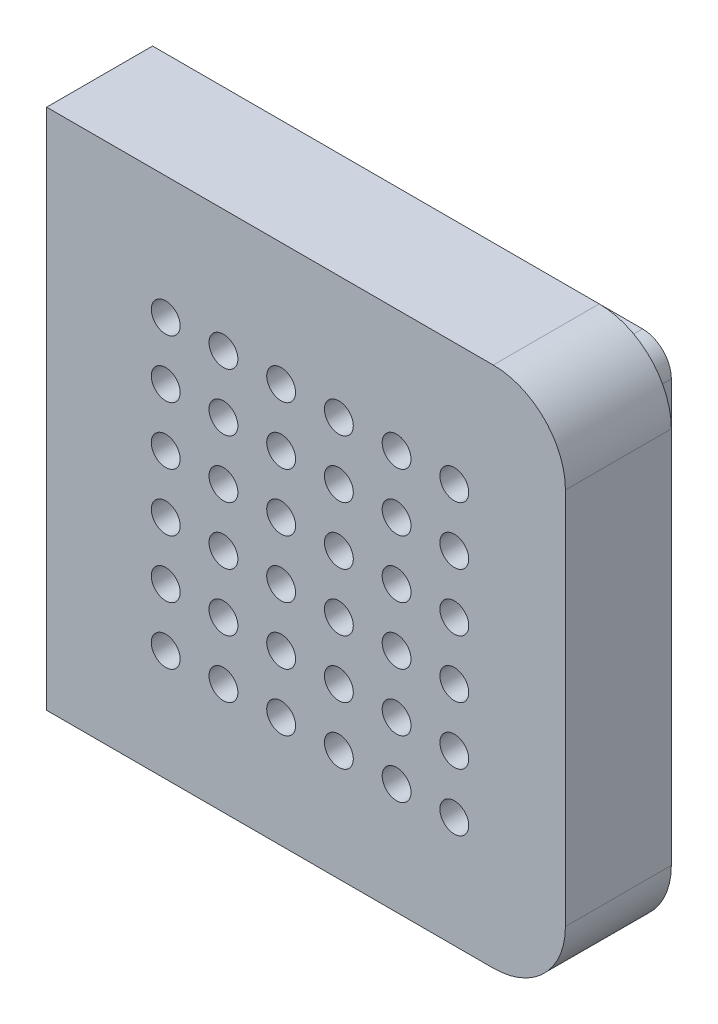
from build123d import *

# Parameters (mm, degrees)
BOSS_EXTRUDE1_DEPTH = 3.67
SKETCH6_R           = 0.5
CUT_EXTRUDE1_DEPTH  = 3.67
SKETCH20_W          = 12.1
SKETCH20_H          = 12.1
BOSS_EXTRUDE4_DEPTH = 1.5
SKETCH13_W          = 1
SKETCH13_H          = 0.5
CUT_EXTRUDE7_DEPTH  = 0.5
SKETCH14_R          = 0.125
CUT_EXTRUDE8_DEPTH  = 0.25
CUT_EXTRUDE9_START  = -0.25
SKETCH15_R          = 0.125
CUT_EXTRUDE9_DEPTH  = 0.25
CUT_EXTRUDE10_START = -0.25
SKETCH16_R          = 0.125
CUT_EXTRUDE10_DEPTH = 0.25
SKETCH17_R          = 0.125
CUT_EXTRUDE11_DEPTH = 0.25
SKETCH19_W          = 3.67
SKETCH19_H          = 18.1
CUT_EXTRUDE13_DEPTH = 0.125
CUT_EXTRUDE14_REACH = 22.457


with BuildPart() as part:
    # Sketch1 → Boss-Extrude1 (new body)
    with BuildSketch(Plane.XY):
        with BuildLine():
            Line((-7.8, 9.05), (7.8, 9.05))
            ThreePointArc((7.8, 9.05), (9.567766953, 8.317766953), (10.3, 6.55))
            Line((10.3, 6.55), (10.3, -6.55))
            ThreePointArc((10.3, -6.55), (9.567766953, -8.317766953), (7.8, -9.05))
            Line((7.8, -9.05), (-7.8, -9.05))
            Line((-7.8, -9.05), (-7.8, 9.05))
        make_face()
    extrude(amount=BOSS_EXTRUDE1_DEPTH)

    # Sketch6 → Cut-Extrude1 (cut)
    with BuildSketch(Plane.XY.offset(3.67)):
        with Locations((-3.55, 4.8)):
            Circle(SKETCH6_R)
        with Locations((-1.55, 4.8)):
            Circle(SKETCH6_R)
        with Locations((0.45, 4.8)):
            Circle(SKETCH6_R)
        with Locations((2.45, 4.8)):
            Circle(SKETCH6_R)
        with Locations((4.45, 4.8)):
            Circle(SKETCH6_R)
        with Locations((6.45, 4.8)):
            Circle(SKETCH6_R)
        with Locations((-1.55, 2.8)):
            Circle(SKETCH6_R)
        with Locations((0.45, 2.8)):
            Circle(SKETCH6_R)
        with Locations((2.45, 2.8)):
            Circle(SKETCH6_R)
        with Locations((4.45, 2.8)):
            Circle(SKETCH6_R)
        with Locations((6.45, 2.8)):
            Circle(SKETCH6_R)
        with Locations((-1.55, 0.8)):
            Circle(SKETCH6_R)
        with Locations((0.45, 0.8)):
            Circle(SKETCH6_R)
        with Locations((2.45, 0.8)):
            Circle(SKETCH6_R)
        with Locations((4.45, 0.8)):
            Circle(SKETCH6_R)
        with Locations((6.45, 0.8)):
            Circle(SKETCH6_R)
        with Locations((-1.55, -1.2)):
            Circle(SKETCH6_R)
        with Locations((0.45, -1.2)):
            Circle(SKETCH6_R)
        with Locations((2.45, -1.2)):
            Circle(SKETCH6_R)
        with Locations((4.45, -1.2)):
            Circle(SKETCH6_R)
        with Locations((6.45, -1.2)):
            Circle(SKETCH6_R)
        with Locations((-1.55, -3.2)):
            Circle(SKETCH6_R)
        with Locations((0.45, -3.2)):
            Circle(SKETCH6_R)
        with Locations((2.45, -3.2)):
            Circle(SKETCH6_R)
        with Locations((4.45, -3.2)):
            Circle(SKETCH6_R)
        with Locations((6.45, -3.2)):
            Circle(SKETCH6_R)
        with Locations((-1.55, -5.2)):
            Circle(SKETCH6_R)
        with Locations((0.45, -5.2)):
            Circle(SKETCH6_R)
        with Locations((2.45, -5.2)):
            Circle(SKETCH6_R)
        with Locations((4.45, -5.2)):
            Circle(SKETCH6_R)
        with Locations((6.45, -5.2)):
            Circle(SKETCH6_R)
        with Locations((-3.55, 2.8)):
            Circle(SKETCH6_R)
        with Locations((-3.55, 0.8)):
            Circle(SKETCH6_R)
        with Locations((-3.55, -1.2)):
            Circle(SKETCH6_R)
        with Locations((-3.55, -3.2)):
            Circle(SKETCH6_R)
        with Locations((-3.55, -5.2)):
            Circle(SKETCH6_R)
    extrude(amount=-CUT_EXTRUDE1_DEPTH, mode=Mode.SUBTRACT)

    # Sketch20 → Boss-Extrude4 (add)
    with BuildSketch(Plane(origin=(0, 0, 0), x_dir=(-1, 0, 0), z_dir=(0, 0, -1))):
        with BuildLine():
            Line((6.3, -7.55), (6.3, 7.55))
            Line((6.3, 7.55), (-7.8, 7.55))
            ThreePointArc((-7.8, 7.55), (-8.507106781, 7.257106781), (-8.8, 6.55))
            Line((-8.8, 6.55), (-8.8, -6.55))
            ThreePointArc((-8.8, -6.55), (-8.507106781, -7.257106781), (-7.8, -7.55))
            Line((-7.8, -7.55), (6.3, -7.55))
        make_face()
        with Locations((-1.25, 0)):
            Rectangle(SKETCH20_W, SKETCH20_H, mode=Mode.SUBTRACT)
    extrude(amount=BOSS_EXTRUDE4_DEPTH)

    # Sketch13 → Cut-Extrude7 (cut)
    with BuildSketch(Plane.XZ.offset(9.05)):
        with Locations((-5.5, 0.25)):
            Rectangle(SKETCH13_W, SKETCH13_H)
        with Locations((5.5, 0.25)):
            Rectangle(SKETCH13_W, SKETCH13_H)
    extrude(amount=-CUT_EXTRUDE7_DEPTH, mode=Mode.SUBTRACT)

    # Sketch14 → Cut-Extrude8 (cut)
    with BuildSketch(Plane(origin=(-6, 0, 0), x_dir=(0, 0, -1), z_dir=(1, 0, 0))):
        with Locations(Location((-0.25, -8.8, 0), (0, 0, 90))):
            Circle(SKETCH14_R)
    extrude(amount=-CUT_EXTRUDE8_DEPTH, mode=Mode.SUBTRACT)

    # Sketch15 → Cut-Extrude9 (cut)
    with BuildSketch(Plane.ZY.offset(5).offset(CUT_EXTRUDE9_START)):
        with Locations(Location((0.25, -8.8, 0), (0, 0, 90))):
            Circle(SKETCH15_R)
    extrude(amount=CUT_EXTRUDE9_DEPTH, mode=Mode.SUBTRACT)

    # Sketch16 → Cut-Extrude10 (cut)
    with BuildSketch(Plane.ZY.offset(-6).offset(CUT_EXTRUDE10_START)):
        with Locations(Location((0.25, -8.8, 0), (0, 0, 90))):
            Circle(SKETCH16_R)
    extrude(amount=CUT_EXTRUDE10_DEPTH, mode=Mode.SUBTRACT)

    # Sketch17 → Cut-Extrude11 (cut)
    with BuildSketch(Plane(origin=(5, 0, 0), x_dir=(0, 0, -1), z_dir=(1, 0, 0))):
        with Locations(Location((-0.25, -8.8, 0), (0, 0, 90))):
            Circle(SKETCH17_R)
    extrude(amount=-CUT_EXTRUDE11_DEPTH, mode=Mode.SUBTRACT)

    # Sketch19 → Cut-Extrude13 (cut)
    with BuildSketch(Plane.ZY.offset(7.8)):
        with Locations((1.835, 0)):
            Rectangle(SKETCH19_W, SKETCH19_H)
    extrude(amount=-CUT_EXTRUDE13_DEPTH, mode=Mode.SUBTRACT)

    # Sketch21 → Cut-Extrude14 (cut, up to next)
    with BuildSketch(Plane.ZY.offset(7.675), mode=Mode.PRIVATE) as cut_extrude14_sk1:
        with BuildLine():
            Line((0, -8.55), (0, -9.05))
            Line((0, -9.05), (0.5, -9.05))
            ThreePointArc((0.5, -9.05), (0.146446609, -8.903553391), (0, -8.55))
        make_face()
    cut_extrude14_tool1 = extrude(cut_extrude14_sk1.sketch, amount=-CUT_EXTRUDE14_REACH, mode=Mode.PRIVATE) & part.part
    add(cut_extrude14_tool1.solids().sort_by_distance((-7.675, -8.938316, 0.111684))[0], mode=Mode.SUBTRACT)
    add(cut_extrude14_tool1.solids().sort_by_distance((-7.675, -8.938316, 0.111684))[1], mode=Mode.SUBTRACT)
    add(cut_extrude14_tool1.solids().sort_by_distance((-7.675, -8.938316, 0.111684))[2], mode=Mode.SUBTRACT)


solid = part.part
